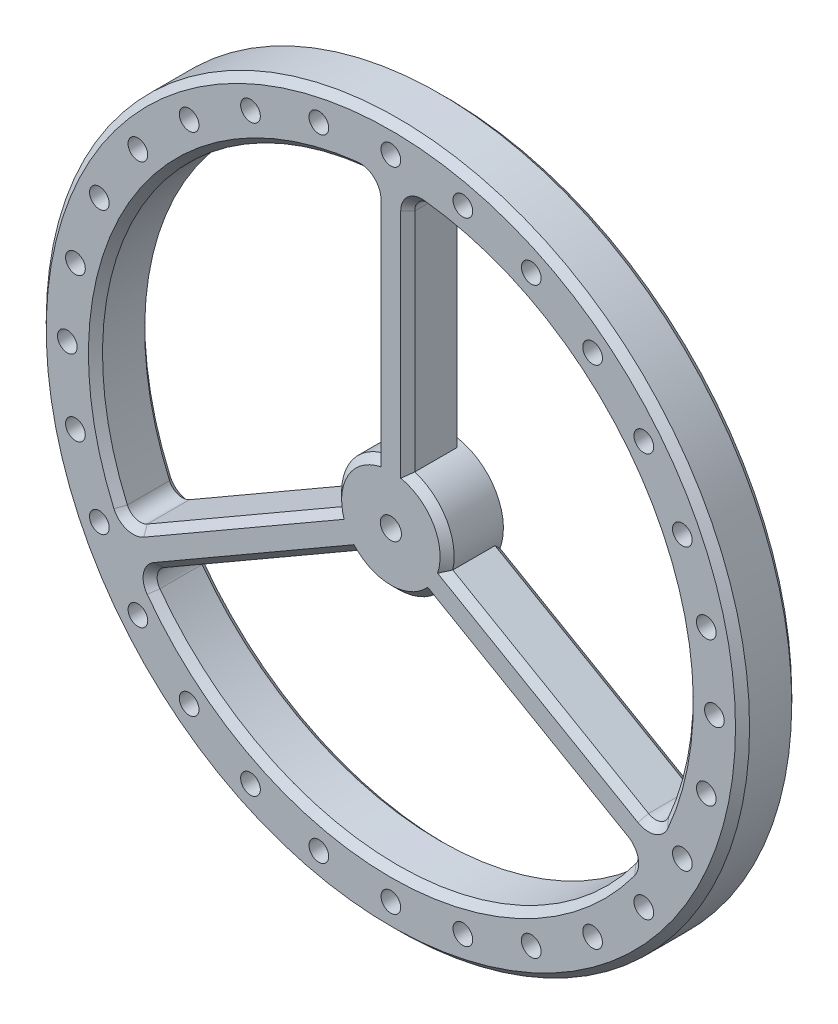
from build123d import *

# Parameters (mm, degrees)
SKETCH1_R           = 62.5
SKETCH1_R_2         = 52.5
BOSS_EXTRUDE1_DEPTH = 10
BOSS_EXTRUDE5_DEPTH = 10
CUT_EXTRUDE2_DEPTH  = 7.25
SKETCH4_R           = 1.875
CUT_EXTRUDE3_DEPTH  = 6
SKETCH5_R           = 1.75
CUT_EXTRUDE4_DEPTH  = 5
FILLET1_R           = 2.5
CHAMFER1_SIZE       = 1.25


with BuildPart() as part:
    # Sketch1 → Boss-Extrude1 (new body)
    with BuildSketch(Plane.XY):
        Circle(SKETCH1_R)
        Circle(SKETCH1_R_2, mode=Mode.SUBTRACT)
    extrude(amount=-BOSS_EXTRUDE1_DEPTH)

    # Sketch2 → Boss-Extrude5 (add)
    with BuildSketch(Plane.XY):
        with BuildLine():
            Line((46.892042254, -23.609031603), (9.761355821, -2.171619796))
            ThreePointArc((9.761355821, -2.171619796), (8.660254038, 5), (3, 9.539392014))
            Line((3, 9.539392014), (3, 52.414215629))
            ThreePointArc((3, 52.414215629), (0, 52.5), (-3, 52.414215629))
            Line((-3, 52.414215629), (-3, 9.539392014))
            ThreePointArc((-3, 9.539392014), (-8.660254038, 5), (-9.761355821, -2.171619796))
            Line((-9.761355821, -2.171619796), (-46.892042254, -23.609031603))
            ThreePointArc((-46.892042254, -23.609031603), (-45.466333699, -26.25), (-43.892042254, -28.805184026))
            Line((-43.892042254, -28.805184026), (-6.761355821, -7.367772218))
            ThreePointArc((-6.761355821, -7.367772218), (0, -10), (6.761355821, -7.367772218))
            Line((6.761355821, -7.367772218), (43.892042254, -28.805184026))
            ThreePointArc((43.892042254, -28.805184026), (45.466333699, -26.25), (46.892042254, -23.609031603))
        make_face()
    extrude(amount=-BOSS_EXTRUDE5_DEPTH)

    # Sketch3 → Cut-Extrude2 (cut)
    with BuildSketch(Plane.XY.offset(-10)):
        Polygon((0, 6), (-5.196152423, 3), (-5.196152423, -3), (0, -6), (5.196152423, -3), (5.196152423, 3), align=None)
    extrude(amount=CUT_EXTRUDE2_DEPTH, mode=Mode.SUBTRACT)

    # Sketch4 → Cut-Extrude3 (cut)
    with BuildSketch(Plane.XY):
        Circle(SKETCH4_R)
    extrude(amount=-CUT_EXTRUDE3_DEPTH, mode=Mode.SUBTRACT)

    # Sketch5 → Cut-Extrude4 (cut)
    with BuildSketch(Plane.XY):
        with Locations((12.794953702, 56.05835495)):
            Circle(SKETCH5_R)
        with Locations((0, 57.5)):
            Circle(SKETCH5_R)
        with Locations((24.948314999, 51.805709904)):
            Circle(SKETCH5_R)
        with Locations((35.850663607, 44.955310242)):
            Circle(SKETCH5_R)
        with Locations((44.955310242, 35.850663607)):
            Circle(SKETCH5_R)
        with Locations((51.805709904, 24.948314999)):
            Circle(SKETCH5_R)
        with Locations((56.05835495, 12.794953702)):
            Circle(SKETCH5_R)
        with Locations((57.5, 0)):
            Circle(SKETCH5_R)
        with Locations((56.05835495, -12.794953702)):
            Circle(SKETCH5_R)
        with Locations((51.805709904, -24.948314999)):
            Circle(SKETCH5_R)
        with Locations((44.955310242, -35.850663607)):
            Circle(SKETCH5_R)
        with Locations((35.850663607, -44.955310242)):
            Circle(SKETCH5_R)
        with Locations((24.948314999, -51.805709904)):
            Circle(SKETCH5_R)
        with Locations((12.794953702, -56.05835495)):
            Circle(SKETCH5_R)
        with Locations((0, -57.5)):
            Circle(SKETCH5_R)
        with Locations((-12.794953702, -56.05835495)):
            Circle(SKETCH5_R)
        with Locations((-24.948314999, -51.805709904)):
            Circle(SKETCH5_R)
        with Locations((-35.850663607, -44.955310242)):
            Circle(SKETCH5_R)
        with Locations((-44.955310242, -35.850663607)):
            Circle(SKETCH5_R)
        with Locations((-51.805709904, -24.948314999)):
            Circle(SKETCH5_R)
        with Locations((-56.05835495, -12.794953702)):
            Circle(SKETCH5_R)
        with Locations((-57.5, 0)):
            Circle(SKETCH5_R)
        with Locations((-56.05835495, 12.794953702)):
            Circle(SKETCH5_R)
        with Locations((-51.805709904, 24.948314999)):
            Circle(SKETCH5_R)
        with Locations((-44.955310242, 35.850663607)):
            Circle(SKETCH5_R)
        with Locations((-35.850663607, 44.955310242)):
            Circle(SKETCH5_R)
        with Locations((-24.948314999, 51.805709904)):
            Circle(SKETCH5_R)
        with Locations((-12.794953702, 56.05835495)):
            Circle(SKETCH5_R)
    extrude(amount=-CUT_EXTRUDE4_DEPTH, mode=Mode.SUBTRACT)

    # Fillet1
    fillet1_edges = [part.edges().sort_by_distance(p)[0] for p in [
        (3, 52.414215629, -5),
        (46.892042254, -23.609031603, -5),
        (43.892042254, -28.805184026, -5),
        (-43.892042254, -28.805184026, -5),
        (-46.892042254, -23.609031603, -5),
        (-3, 52.414215629, -5),
    ]]
    fillet(fillet1_edges, radius=FILLET1_R)

    # Chamfer1
    chamfer1_edges = [part.edges().sort_by_distance(p)[0] for p in [
        (3, 29.617985687, -10),
        (27.149928014, -12.210916632, 0),
        (24.149928014, -17.407069055, -10),
        (-24.149928014, -17.407069055, 0),
        (-27.149928014, -12.210916632, -10),
        (-3, 29.617985687, 0),
        (-62.5, 0, 0),
        (27.149928014, -12.210916632, -10),
        (-24.149928014, -17.407069055, -10),
        (-3, 29.617985687, -10),
        (3, 29.617985687, 0),
        (-8.660254038, 5, 0),
        (-27.149928014, -12.210916632, 0),
        (0, -10, 0),
        (24.149928014, -17.407069055, 0),
        (45.466333699, 26.25, 0),
        (45.466333699, 26.25, -10),
        (8.660254038, 5, 0),
        (0, -52.5, 0),
        (0, -52.5, -10),
        (-45.466333699, 26.25, 0),
        (-45.466333699, 26.25, -10),
        (46.56758219, -22.460656486, 0),
        (46.56758219, -22.460656486, -10),
        (42.735290198, -29.098380926, 0),
        (42.735290198, -29.098380926, -10),
        (-42.735290198, -29.098380926, 0),
        (-42.735290198, -29.098380926, -10),
        (-46.56758219, -22.460656486, 0),
        (-46.56758219, -22.460656486, -10),
        (3.832291992, 51.559037412, 0),
        (3.832291992, 51.559037412, -10),
        (-3.832291992, 51.559037412, 0),
        (-3.832291992, 51.559037412, -10),
        (-62.5, 0, -10),
    ]]
    chamfer(chamfer1_edges, length=CHAMFER1_SIZE)


solid = part.part
